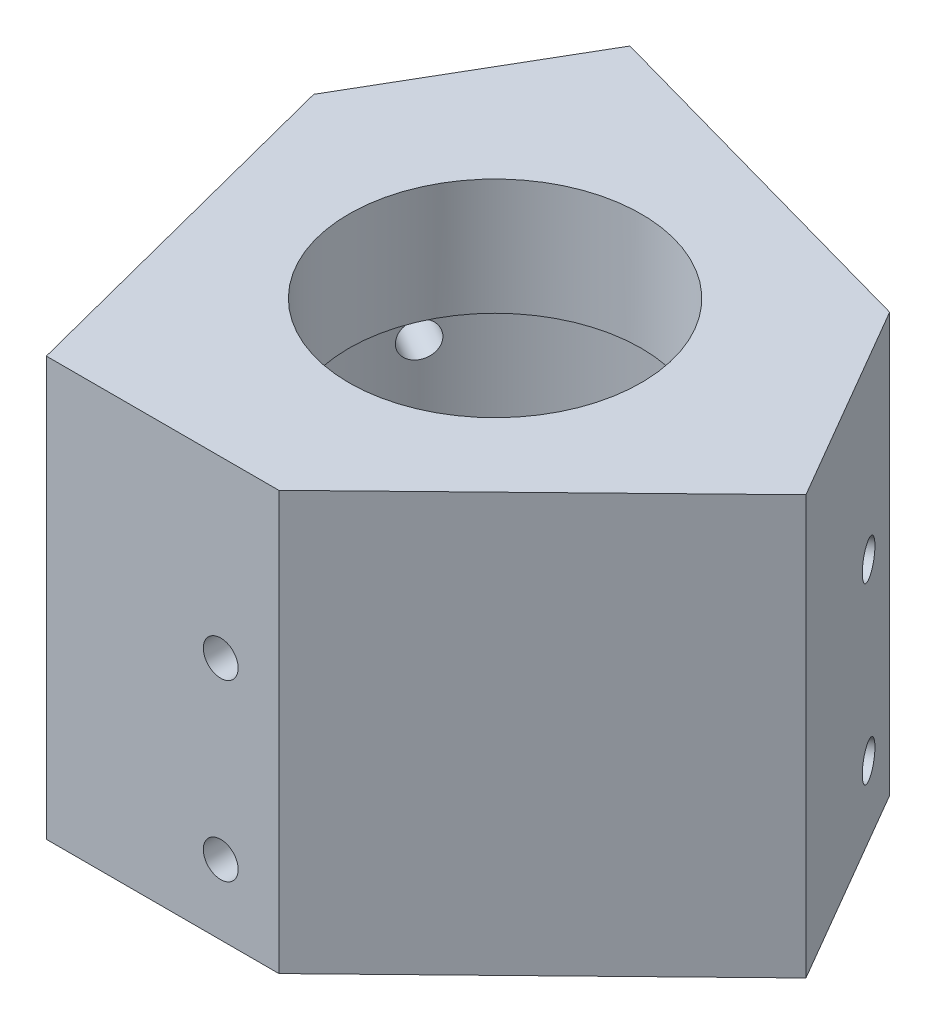
from build123d import *

# Parameters (mm, degrees)
SKETCH2_R               = 12.575
BOSS_EXTRUDE1_DEPTH     = 36
SKETCH3_R               = 17.5
CUT_EXTRUDE1_DEPTH      = 26
CUT_EXTRUDE2_REACH      = 68.591
CUT_EXTRUDE2_END_RADIUS = 17.5
SKETCH4_R               = 1.5
CUT_EXTRUDE5_REACH      = 71.976
CUT_EXTRUDE5_END_RADIUS = 17.5
SKETCH7_R               = 1.5
CUT_EXTRUDE6_REACH      = 68.357
CUT_EXTRUDE6_END_RADIUS = 17.5
SKETCH8_R               = 1.5


with BuildPart() as part:
    # Sketch2 → Boss-Extrude1 (new body)
    with BuildSketch(Plane(origin=(0, 0, 0), x_dir=(1, 0, 0), z_dir=(0, 1, 0))):
        Polygon((-23, 7.4), (-15, -23.6), (5, -23.6), (28, -1.26), (18, 15.94), (-13, 24.6), align=None)
        with Locations(Location((0, 0, 0), (0, 0, 270))):
            Circle(SKETCH2_R, mode=Mode.SUBTRACT)
    extrude(amount=-BOSS_EXTRUDE1_DEPTH)

    # Sketch3 → Cut-Extrude1 (cut)
    with BuildSketch(Plane.XZ.offset(36)):
        with Locations(Location((0, 0, 0), (0, 0, 270))):
            Circle(SKETCH3_R)
    extrude(amount=-CUT_EXTRUDE1_DEPTH, mode=Mode.SUBTRACT)

    # Cut-Extrude2: up to this cylinder (the profile starts outside it)
    cut_extrude2_end = Plane(origin=(0, -22.5, 0), z_dir=(0, -1, 0)) * Cylinder(CUT_EXTRUDE2_END_RADIUS, 188.182, mode=Mode.PRIVATE)
    # Sketch4 → Cut-Extrude2 (cut, up to the surface)
    with BuildSketch(Plane(origin=(20.378940986, 0, -11.848221504), x_dir=(-0.5026204573745311, 0, -0.8645071866841925), z_dir=(0.8645071866841925, 0, -0.5026204573745311)), mode=Mode.PRIVATE) as cut_extrude2_sk1:
        with Locations((-0.266923677, -15)):
            Circle(SKETCH4_R)
    cut_extrude2_tool1 = extrude(cut_extrude2_sk1.sketch, amount=-CUT_EXTRUDE2_REACH, mode=Mode.PRIVATE) - cut_extrude2_end
    add(cut_extrude2_tool1.solids().sort_by_distance((20.513102, -15, -11.617464))[0], mode=Mode.SUBTRACT)
    # Sketch4 → Cut-Extrude2 (cut, up to the surface)
    with BuildSketch(Plane(origin=(20.378940986, 0, -11.848221504), x_dir=(-0.5026204573745311, 0, -0.8645071866841925), z_dir=(0.8645071866841925, 0, -0.5026204573745311)), mode=Mode.PRIVATE) as cut_extrude2_sk2:
        with Locations((-0.266923677, -30)):
            Circle(SKETCH4_R)
    cut_extrude2_tool2 = extrude(cut_extrude2_sk2.sketch, amount=-CUT_EXTRUDE2_REACH, mode=Mode.PRIVATE) - cut_extrude2_end
    add(cut_extrude2_tool2.solids().sort_by_distance((20.513102, -30, -11.617464))[0], mode=Mode.SUBTRACT)

    # Cut-Extrude5: up to this cylinder (the profile starts outside it)
    cut_extrude5_end = Plane(origin=(0, -22.5, 0), z_dir=(0, -1, 0)) * Cylinder(CUT_EXTRUDE5_END_RADIUS, 194.952, mode=Mode.PRIVATE)
    # Sketch7 → Cut-Extrude5 (cut, up to the surface)
    with BuildSketch(Plane(origin=(-20.405012126, 0, -11.863379143), x_dir=(-0.5026204573745304, 0, 0.8645071866841929), z_dir=(-0.8645071866841929, 0, -0.5026204573745304)), mode=Mode.PRIVATE) as cut_extrude5_sk1:
        with Locations((0.162917338, -30)):
            Circle(SKETCH7_R)
    cut_extrude5_tool1 = extrude(cut_extrude5_sk1.sketch, amount=-CUT_EXTRUDE5_REACH, mode=Mode.PRIVATE) - cut_extrude5_end
    add(cut_extrude5_tool1.solids().sort_by_distance((-20.486898, -30, -11.722536))[0], mode=Mode.SUBTRACT)
    # Sketch7 → Cut-Extrude5 (cut, up to the surface)
    with BuildSketch(Plane(origin=(-20.405012126, 0, -11.863379143), x_dir=(-0.5026204573745304, 0, 0.8645071866841929), z_dir=(-0.8645071866841929, 0, -0.5026204573745304)), mode=Mode.PRIVATE) as cut_extrude5_sk2:
        with Locations((0.162917338, -15)):
            Circle(SKETCH7_R)
    cut_extrude5_tool2 = extrude(cut_extrude5_sk2.sketch, amount=-CUT_EXTRUDE5_REACH, mode=Mode.PRIVATE) - cut_extrude5_end
    add(cut_extrude5_tool2.solids().sort_by_distance((-20.486898, -15, -11.722536))[0], mode=Mode.SUBTRACT)

    # Cut-Extrude6: up to this cylinder (the profile starts outside it)
    cut_extrude6_end = Plane(origin=(0, -22.5, 0), z_dir=(0, -1, 0)) * Cylinder(CUT_EXTRUDE6_END_RADIUS, 187.714, mode=Mode.PRIVATE)
    # Sketch8 → Cut-Extrude6 (cut, up to the surface)
    with BuildSketch(Plane.XY.offset(23.6), mode=Mode.PRIVATE) as cut_extrude6_sk1:
        with Locations((0, -30)):
            Circle(SKETCH8_R)
    cut_extrude6_tool1 = extrude(cut_extrude6_sk1.sketch, amount=-CUT_EXTRUDE6_REACH, mode=Mode.PRIVATE) - cut_extrude6_end
    add(cut_extrude6_tool1.solids().sort_by_distance((0, -30, 23.6))[0], mode=Mode.SUBTRACT)
    # Sketch8 → Cut-Extrude6 (cut, up to the surface)
    with BuildSketch(Plane.XY.offset(23.6), mode=Mode.PRIVATE) as cut_extrude6_sk2:
        with Locations((0, -15)):
            Circle(SKETCH8_R)
    cut_extrude6_tool2 = extrude(cut_extrude6_sk2.sketch, amount=-CUT_EXTRUDE6_REACH, mode=Mode.PRIVATE) - cut_extrude6_end
    add(cut_extrude6_tool2.solids().sort_by_distance((0, -15, 23.6))[0], mode=Mode.SUBTRACT)


solid = part.part
